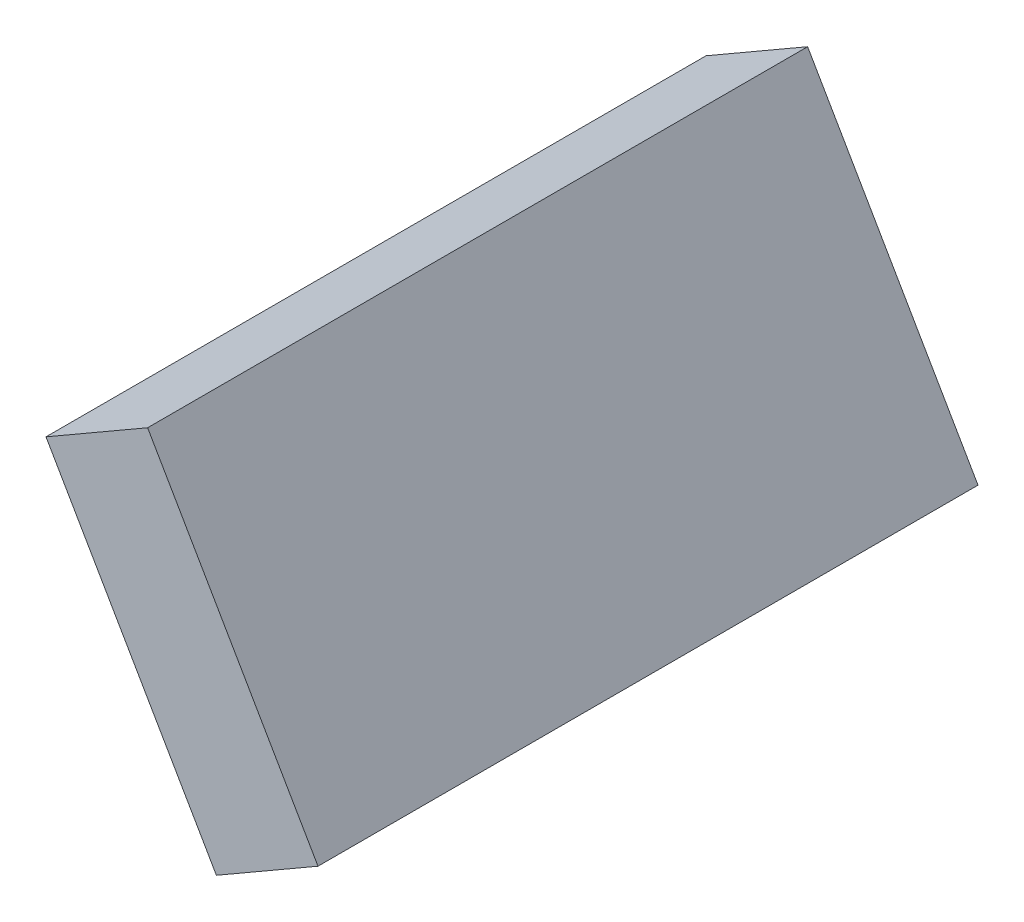
from build123d import *

# Parameters (mm, degrees)
BOSS_EXTRUDE2_DEPTH = 112.5


with BuildPart() as part:
    # Sketch4 → Boss-Extrude2 (new body)
    with BuildSketch(Plane.XY):
        Polygon((-498.325099265, -177.853688571), (-469.284028526, -228.059449788), (-486.604536601, -238.059449788), (-515.64560734, -187.853688571), align=None)
    extrude(amount=BOSS_EXTRUDE2_DEPTH)


solid = part.part
